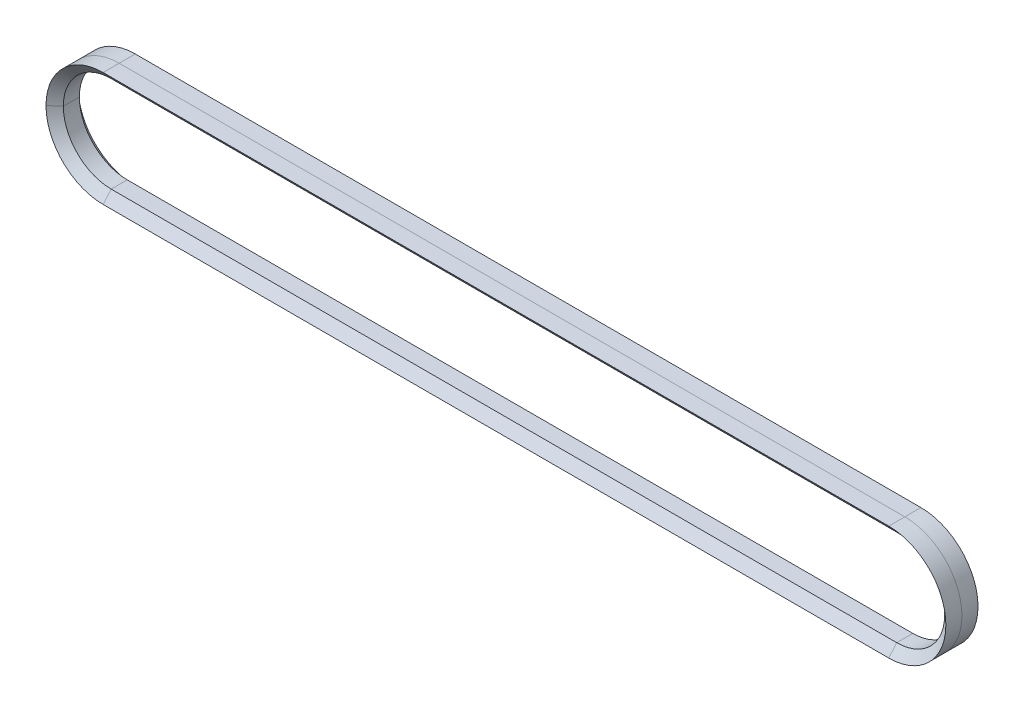
from build123d import *


with BuildPart() as part:
    # 扫描1: sweep along a path in 草图1
    with BuildLine(Plane.XY) as sweep_1_path:
        Line((-90, 16), (130, 16))
        ThreePointArc((130, 16), (146, 0), (130, -16))
        Line((130, -16), (-90, -16))
        ThreePointArc((-90, -16), (-106, 0), (-90, 16))
    # 草图2 → 扫描1 (sweep)
    with BuildSketch(Plane(origin=(0, 0, 0), x_dir=(1, 0, 0), z_dir=(0, 1, 0))):
        Polygon((-106, 0), (-106, 4.5), (-103.4, 2.25), (-103.4, -2.25), (-106, -4.5), align=None)
    sweep(path=sweep_1_path.line)


solid = part.part
